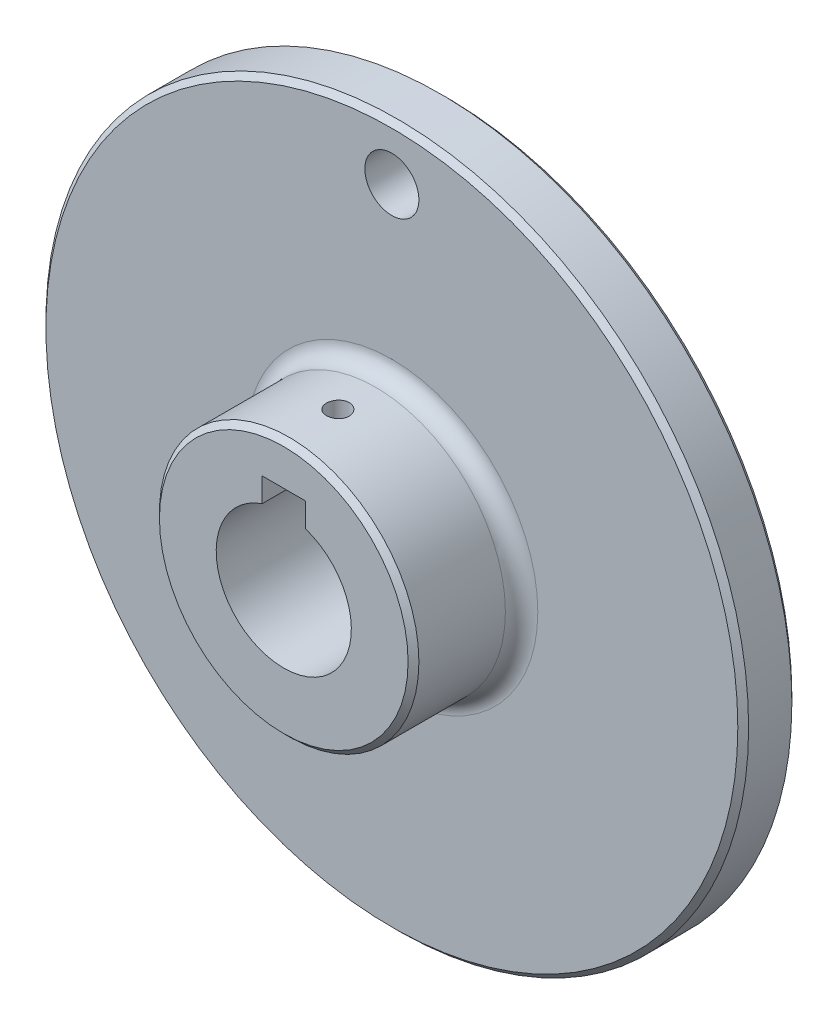
from build123d import *

# Parameters (mm, degrees)
SKETCH1_R             = 65
SKETCH1_R_2           = 5
SKETCH1_R_3           = 12.5
BOSS_EXTRUDE1_DEPTH   = 10
SKETCH2_R             = 24
SKETCH2_R_2           = 12.5
BOSS_EXTRUDE2_DEPTH   = 20
CHAMFER1_SIZE         = 1
FILLET1_R             = 3
CHAMFER2_SIZE         = 1
SKETCH4_W             = 8
SKETCH4_H             = 16.3
CUT_EXTRUDE2_DEPTH    = 97.695398029
M5_TAPPED_HOLE1_D     = 4.2
M5_TAPPED_HOLE1_DEPTH = 12.4
M5_TAPPED_HOLE1_TIP   = 1.2618073


with BuildPart() as part:
    # Sketch1 → Boss-Extrude1 (new body)
    with BuildSketch(Plane.XY):
        Circle(SKETCH1_R)
        with Locations((0, 55)):
            Circle(SKETCH1_R_2, mode=Mode.SUBTRACT)
        Circle(SKETCH1_R_3, mode=Mode.SUBTRACT)
    extrude(amount=BOSS_EXTRUDE1_DEPTH)

    # Sketch2 → Boss-Extrude2 (add)
    with BuildSketch(Plane.XY.offset(10)):
        Circle(SKETCH2_R)
        Circle(SKETCH2_R_2, mode=Mode.SUBTRACT)
    extrude(amount=BOSS_EXTRUDE2_DEPTH)

    # Chamfer1
    chamfer1_edges = [part.edges().sort_by_distance(p)[0] for p in [
        (-65, 0, 0),
        (-65, 0, 10),
    ]]
    chamfer(chamfer1_edges, length=CHAMFER1_SIZE)

    # Fillet1
    fillet1_edges = [part.edges().sort_by_distance(p)[0] for p in [
        (-24, 0, 10),
    ]]
    fillet(fillet1_edges, radius=FILLET1_R)

    # Chamfer2
    chamfer2_edges = [part.edges().sort_by_distance(p)[0] for p in [
        (-24, 0, 30),
    ]]
    chamfer(chamfer2_edges, length=CHAMFER2_SIZE)

    # Sketch4 → Cut-Extrude2 (cut, through all)
    with BuildSketch(Plane.XY.offset(30)):
        with Locations((0, 8.15)):
            Rectangle(SKETCH4_W, SKETCH4_H)
    extrude(amount=-CUT_EXTRUDE2_DEPTH, mode=Mode.SUBTRACT)

    # M5 Tapped Hole1
    with Locations(Plane(origin=(0, 16.3, 0), x_dir=(-1, 0, 0), z_dir=(0, -1, 0))):
        with Locations((0, -20)):
            Hole(M5_TAPPED_HOLE1_D / 2, depth=M5_TAPPED_HOLE1_DEPTH)
            with Locations((0, 0, -(M5_TAPPED_HOLE1_DEPTH + M5_TAPPED_HOLE1_TIP / 2))):  # 118° drill point
                Cone(0, M5_TAPPED_HOLE1_D / 2, M5_TAPPED_HOLE1_TIP, mode=Mode.SUBTRACT)


solid = part.part
